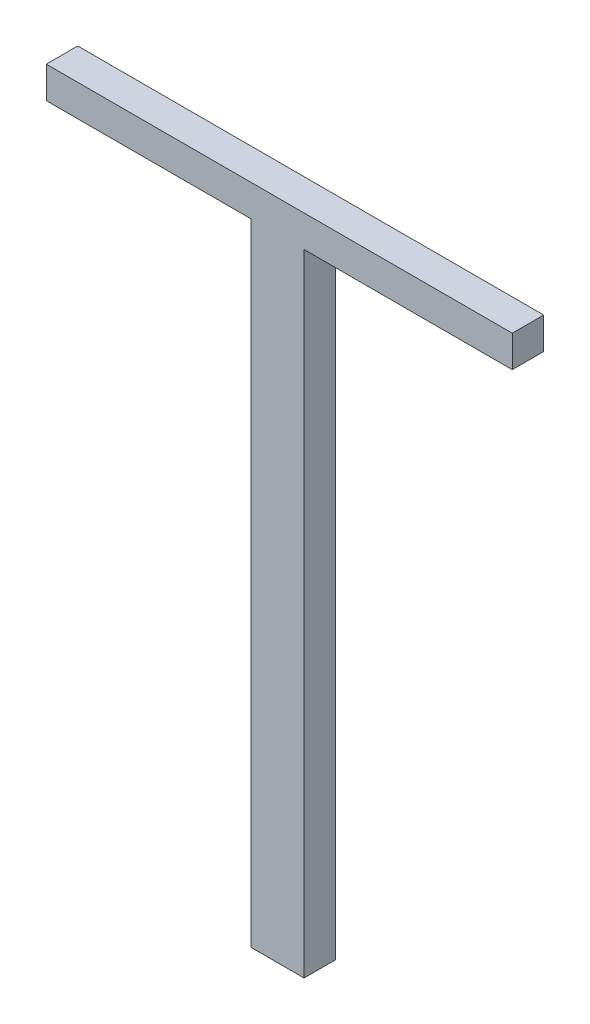
from build123d import *

# Parameters (mm, degrees)
EXTRUDE_1_DEPTH = 50


with BuildPart() as part:
    # Эскиз1 → Бобышка-Вытянуть1 (new body)
    with BuildSketch(Plane.XY):
        Polygon((-26.035949968, -167.496729449), (-26.035949968, 835.724917266), (-351.793024616, 835.724917266), (-351.793024616, 886.007674206), (389.114652518, 886.007674206), (389.114652518, 835.724917266), (58.018707519, 835.724917266), (58.018707519, -167.496729449), align=None)
    extrude(amount=EXTRUDE_1_DEPTH)


solid = part.part
